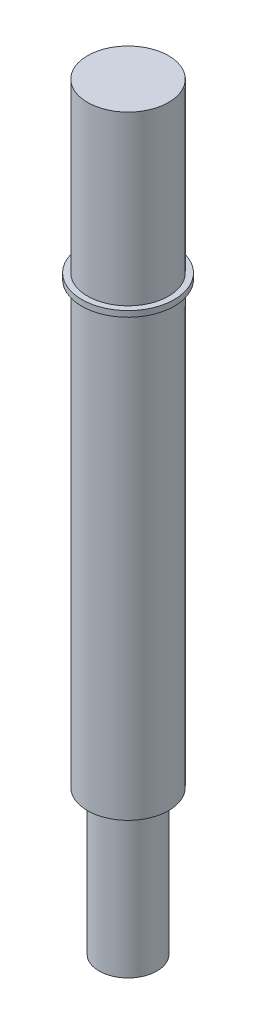
from build123d import *

# Parameters (mm, degrees)
SKETCH1_W = 0.254
SKETCH1_H = 0.254


with BuildPart() as part:
    # Sketch1 → Revolve2 (revolve)
    with BuildSketch(Plane.XY, mode=Mode.PRIVATE) as revolve2_sk:
        Polygon((0, -33.274), (0, 0), (1.778, 0), (1.778, -26.924), (1.27, -26.924), (1.27, -33.274), align=None)
        with Locations((1.905, -7.493)):
            Rectangle(SKETCH1_W, SKETCH1_H)
    revolve(revolve2_sk.sketch.rotate(Axis((0, 0, 0), (0, 1, 0)), 90), axis=Axis((0, 0, 0), (0, 1, 0)))


solid = part.part
